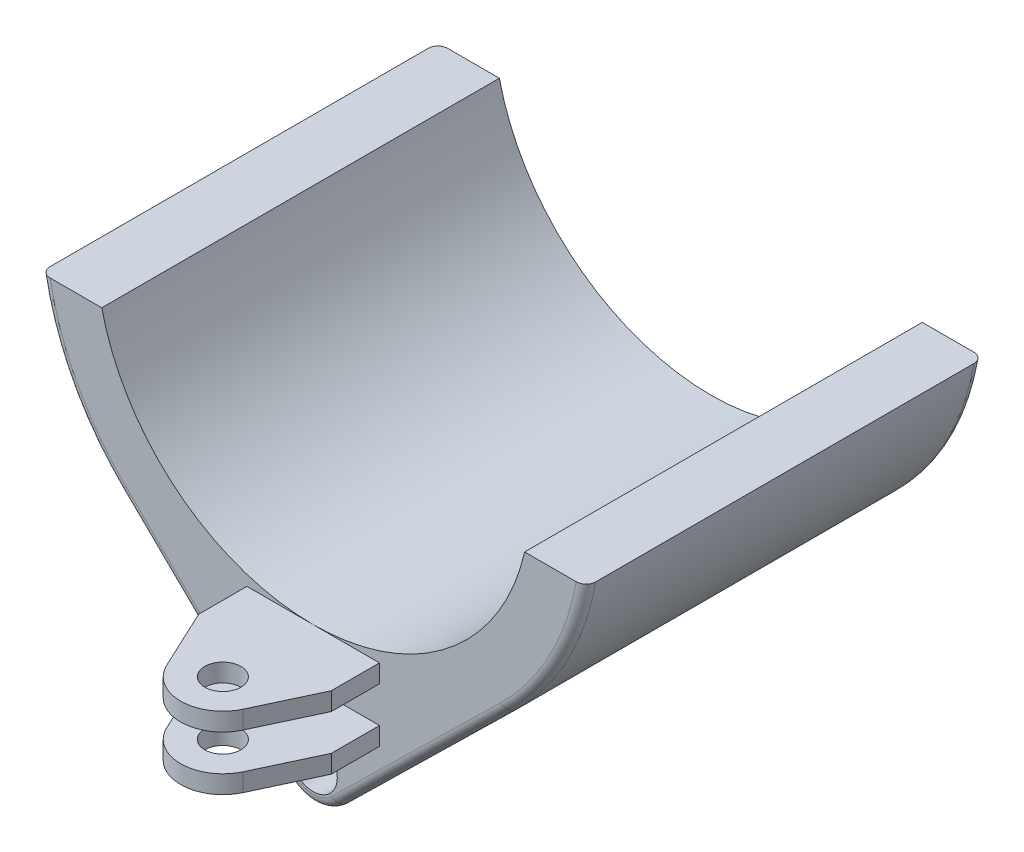
from build123d import *

# Parameters (mm, degrees)
SKETCH1_R           = 20
BOSS_EXTRUDE1_DEPTH = 165
BOSS_EXTRUDE2_START = 40
SKETCH2_R           = 15
BOSS_EXTRUDE2_DEPTH = 60
SKETCH3_W           = 206.239754747
SKETCH3_H           = 30
CUT_EXTRUDE1_DEPTH  = 173.5
SKETCH4_W           = 210
SKETCH4_H           = 170.517407572
CUT_EXTRUDE2_DEPTH  = 1054.5
FILLET1_R           = 4
FILLET2_R           = 8


with BuildPart() as part:
    # Sketch1 → Boss-Extrude1 (new, symmetric)
    with BuildSketch(Plane.XY):
        with BuildLine():
            Line((-226.495033058, 240), (-175.499287748, 240))
            ThreePointArc((-175.499287748, 240), (0, 100), (175.499287748, 240))
            Line((175.499287748, 240), (226.495033058, 240))
            ThreePointArc((226.495033058, 240), (203.453529219, 172.730892386), (160.966468811, 115.714285714))
            Line((160.966468811, 115.714285714), (20.995626367, -21.428571429))
            ThreePointArc((20.995626367, -21.428571429), (0, -30), (-20.995626367, -21.428571429))
            Line((-20.995626367, -21.428571429), (-160.966468811, 115.714285714))
            ThreePointArc((-160.966468811, 115.714285714), (-203.453529219, 172.730892386), (-226.495033058, 240))
        make_face()
        Circle(SKETCH1_R, mode=Mode.SUBTRACT)
    extrude(amount=BOSS_EXTRUDE1_DEPTH, both=True)

    # Sketch2 → Boss-Extrude2 (add)
    with BuildSketch(Plane(origin=(0, 0, 0), x_dir=(1, 0, 0), z_dir=(0, 1, 0)).offset(BOSS_EXTRUDE2_START)):
        with BuildLine():
            Line((-55, -165), (55, -165))
            Line((55, -165), (55, -205))
            Line((55, -205), (31.705882353, -254.823529412))
            ThreePointArc((31.705882353, -254.823529412), (0, -275), (-31.705882353, -254.823529412))
            Line((-31.705882353, -254.823529412), (-55, -205))
            Line((-55, -205), (-55, -165))
        make_face()
        with Locations(Location((0, -240, 0), (0, 0, 90))):
            Circle(SKETCH2_R, mode=Mode.SUBTRACT)
    extrude(amount=BOSS_EXTRUDE2_DEPTH)

    # Sketch3 → Cut-Extrude1 (cut, symmetric)
    with BuildSketch(Plane(origin=(0, 0, 0), x_dir=(0, 0, -1), z_dir=(1, 0, 0))):
        with Locations((-268.119877374, 70)):
            Rectangle(SKETCH3_W, SKETCH3_H)
    extrude(amount=CUT_EXTRUDE1_DEPTH, both=True, mode=Mode.SUBTRACT)

    # Sketch4 → Cut-Extrude2 (cut, symmetric)
    with BuildSketch(Plane(origin=(0, 0, 0), x_dir=(0, 0, -1), z_dir=(1, 0, 0))):
        with Locations((0, 9.741296214)):
            Rectangle(SKETCH4_W, SKETCH4_H)
    extrude(amount=CUT_EXTRUDE2_DEPTH, both=True, mode=Mode.SUBTRACT)

    # Fillet1
    fillet1_edges = [part.edges().sort_by_distance(p)[0] for p in [
        (0, 95, 105),
        (0, 95, -105),
    ]]
    fillet(fillet1_edges, radius=FILLET1_R)

    # Fillet2
    fillet2_edges = [part.edges().sort_by_distance(p)[0] for p in [
        (-90.981047589, 47.142857143, -165),
        (-203.453529219, 172.730892386, -165),
        (-203.453529219, 172.730892386, 165),
        (-90.981047589, 47.142857143, 165),
        (0, -30, 165),
        (90.981047589, 47.142857143, 165),
        (203.453529219, 172.730892386, 165),
        (203.453529219, 172.730892386, -165),
        (90.981047589, 47.142857143, -165),
        (0, -30, -165),
    ]]
    fillet(fillet2_edges, radius=FILLET2_R)


solid = part.part
